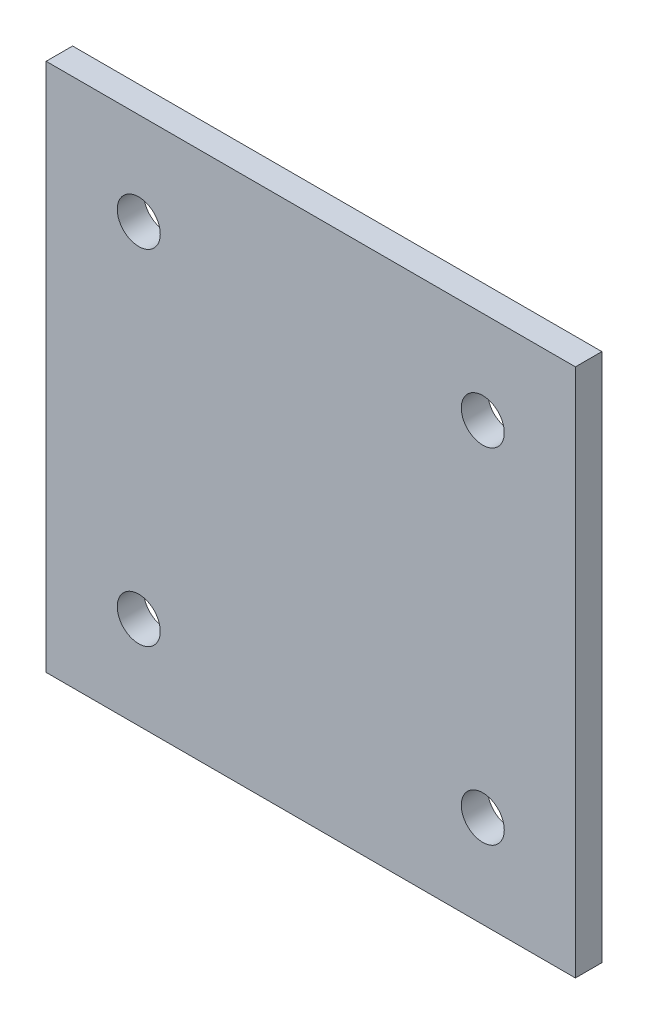
from build123d import *

# Parameters (mm, degrees)
SKETCH2_W           = 40
SKETCH2_H           = 40
SKETCH2_R           = 1.625
BOSS_EXTRUDE1_DEPTH = 2


with BuildPart() as part:
    # Sketch2 → Boss-Extrude1 (new body)
    with BuildSketch(Plane.XY):
        Rectangle(SKETCH2_W, SKETCH2_H)
        with Locations((-13, 13)):
            Circle(SKETCH2_R, mode=Mode.SUBTRACT)
        with Locations(Location((-13, -13, 0), (0, 0, 180))):
            Circle(SKETCH2_R, mode=Mode.SUBTRACT)
        with Locations((13, -13)):
            Circle(SKETCH2_R, mode=Mode.SUBTRACT)
        with Locations(Location((13, 13, 0), (0, 0, 180))):
            Circle(SKETCH2_R, mode=Mode.SUBTRACT)
    extrude(amount=BOSS_EXTRUDE1_DEPTH)


solid = part.part
